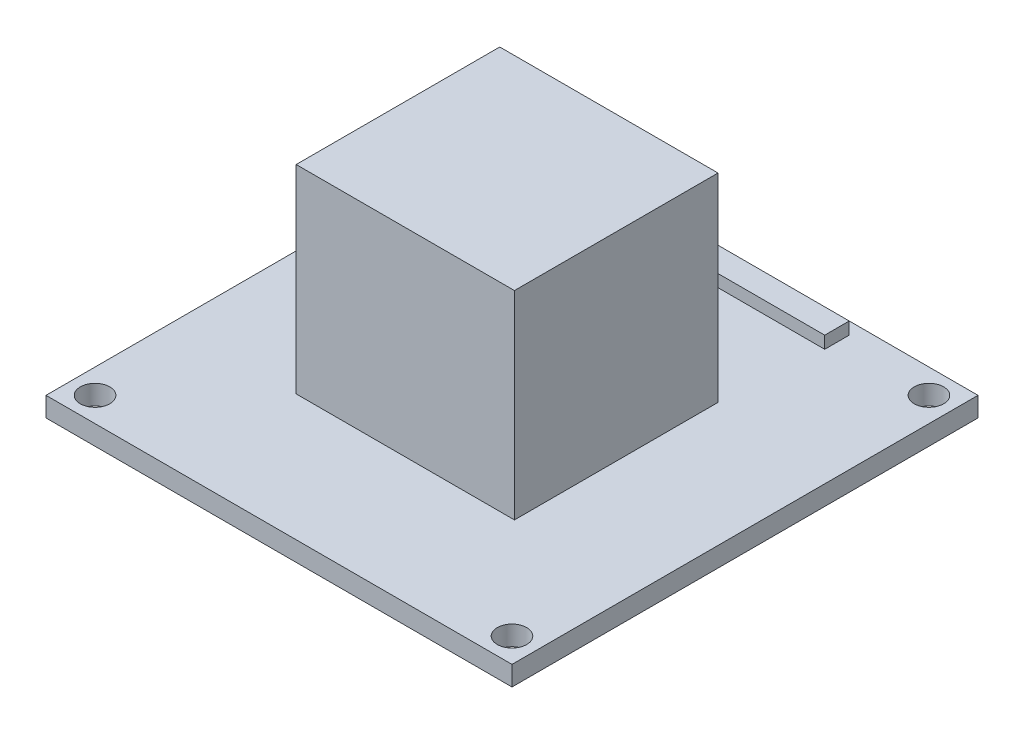
from build123d import *

# Parameters (mm, degrees)
SKETCH2_W           = 38
SKETCH2_H           = 38
SKETCH2_R           = 1.2
BOSS_EXTRUDE1_DEPTH = 1.6
SKETCH3_W           = 17.8
SKETCH3_H           = 16.6
BOSS_EXTRUDE2_DEPTH = 16.2
SKETCH4_W           = 19
SKETCH4_H           = 2
BOSS_EXTRUDE3_DEPTH = 1


with BuildPart() as part:
    # Sketch2 → Boss-Extrude1 (new body)
    with BuildSketch(Plane(origin=(0, 0, 0), x_dir=(1, 0, 0), z_dir=(0, 1, 0))):
        Rectangle(SKETCH2_W, SKETCH2_H)
        with Locations(Location((-17, 17, 0), (0, 0, 270))):
            Circle(SKETCH2_R, mode=Mode.SUBTRACT)
        with Locations(Location((17, 17, 0), (0, 0, 270))):
            Circle(SKETCH2_R, mode=Mode.SUBTRACT)
        with Locations(Location((17, -17, 0), (0, 0, 270))):
            Circle(SKETCH2_R, mode=Mode.SUBTRACT)
        with Locations(Location((-17, -17, 0), (0, 0, 270))):
            Circle(SKETCH2_R, mode=Mode.SUBTRACT)
    extrude(amount=BOSS_EXTRUDE1_DEPTH)

    # Sketch3 → Boss-Extrude2 (add)
    with BuildSketch(Plane(origin=(0, 1.6, 0), x_dir=(1, 0, 0), z_dir=(0, 1, 0))):
        with Locations((0, -0.4)):
            Rectangle(SKETCH3_W, SKETCH3_H)
    extrude(amount=BOSS_EXTRUDE2_DEPTH)

    # Sketch4 → Boss-Extrude3 (add)
    with BuildSketch(Plane(origin=(0, 1.6, 0), x_dir=(1, 0, 0), z_dir=(0, 1, 0))):
        with Locations((0, 17)):
            Rectangle(SKETCH4_W, SKETCH4_H)
    extrude(amount=BOSS_EXTRUDE3_DEPTH)


solid = part.part
